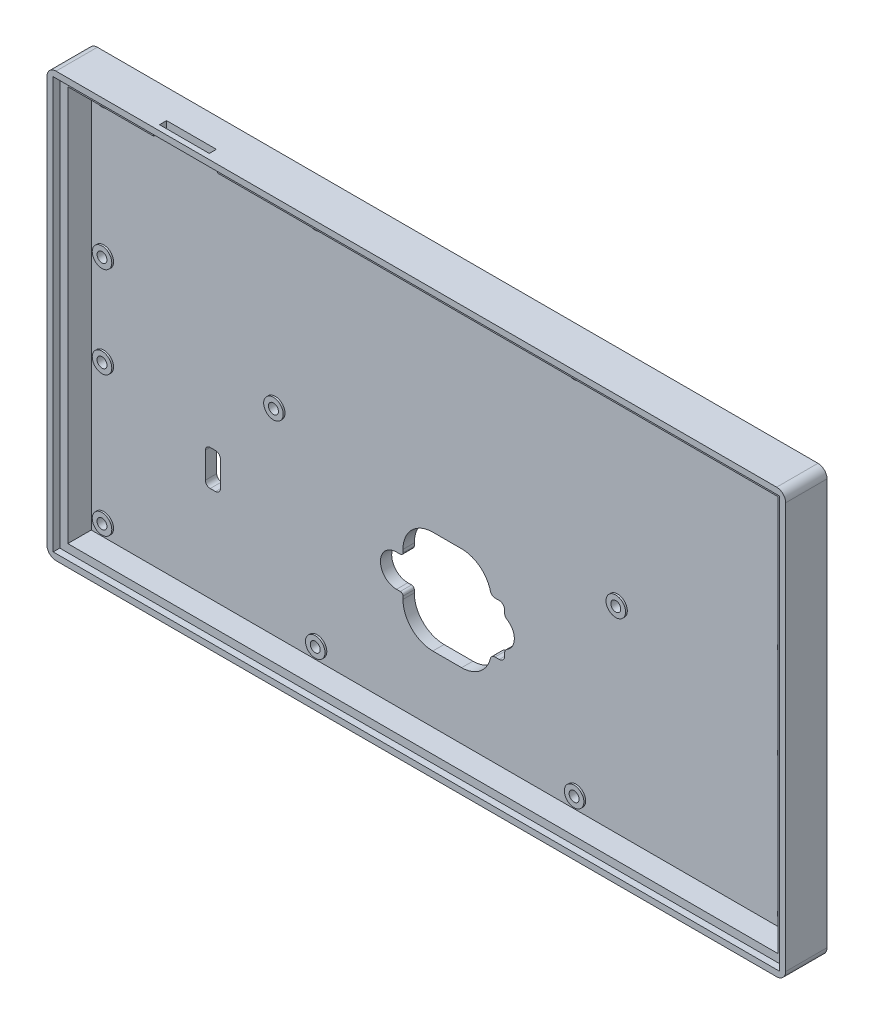
from build123d import *

# Parameters (mm, degrees)
SKETCH4_W           = 207.7922
SKETCH4_H           = 119.2772
SKETCH4_W_2         = 204.2922
SKETCH4_H_2         = 115.7772
BOSS_EXTRUDE1_DEPTH = 1.8542
SKETCH5_W           = 207.7922
SKETCH5_H           = 119.2772
SKETCH5_W_2         = 199.78624
SKETCH5_H_2         = 111.32204
BOSS_EXTRUDE2_DEPTH = 6.604
SKETCH6_W           = 207.7922
SKETCH6_H           = 119.2772
BOSS_EXTRUDE3_DEPTH = 3.175
FILLET1_R           = 2.54
CUT_EXTRUDE2_REACH  = 122.095
SKETCH11_R          = 1.4
CUT_EXTRUDE3_REACH  = 160.609
SKETCH12_W          = 14
SKETCH12_H          = 2
SKETCH13_W          = 18
SKETCH13_H          = 2.22758
CUT_EXTRUDE4_DEPTH  = 1.6458
BOSS_EXTRUDE4_START = 0.5
SKETCH14_R          = 2.75
SKETCH14_R_2        = 1.4
BOSS_EXTRUDE4_DEPTH = 0.5
CUT_EXTRUDE5_REACH  = 122.095


with BuildPart() as part:
    # Sketch4 → Boss-Extrude1 (new body)
    with BuildSketch(Plane.XY):
        Rectangle(SKETCH4_W, SKETCH4_H)
        Rectangle(SKETCH4_W_2, SKETCH4_H_2, mode=Mode.SUBTRACT)
    extrude(amount=-BOSS_EXTRUDE1_DEPTH)

    # Sketch5 → Boss-Extrude2 (add)
    with BuildSketch(Plane(origin=(0, 0, -1.8542), x_dir=(-1, 0, 0), z_dir=(0, 0, -1))):
        Rectangle(SKETCH5_W, SKETCH5_H)
        Rectangle(SKETCH5_W_2, SKETCH5_H_2, mode=Mode.SUBTRACT)
    extrude(amount=BOSS_EXTRUDE2_DEPTH)

    # Sketch6 → Boss-Extrude3 (add)
    with BuildSketch(Plane(origin=(0, 0, -8.4582), x_dir=(-1, 0, 0), z_dir=(0, 0, -1))):
        Rectangle(SKETCH6_W, SKETCH6_H)
        with BuildLine():
            Line((12.20978, -27.9219), (12.20978, -28.722))
            ThreePointArc((12.20978, -28.722), (9.75474904, -34.64896904), (3.82778, -37.104))
            Line((3.82778, -37.104), (-4.286513327, -37.104))
            ThreePointArc((-4.286513327, -37.104), (-9.435955354, -35.33571082), (-12.412717205, -30.776929327))
            ThreePointArc((-12.412717205, -30.776929327), (-12.871637448, -30.074112906), (-13.665514588, -29.8015))
            Line((-13.665514588, -29.8015), (-14.86662, -29.8015))
            ThreePointArc((-14.86662, -29.8015), (-15.944250735, -29.355130735), (-16.39062, -28.2775))
            Line((-16.39062, -28.2775), (-16.39062, -27.445921371))
            ThreePointArc((-16.39062, -27.445921371), (-16.569977638, -26.762670142), (-17.061799901, -26.255607753))
            ThreePointArc((-17.061799901, -26.255607753), (-19.10842, -22.626), (-17.061799901, -18.996392247))
            ThreePointArc((-17.061799901, -18.996392247), (-16.569977638, -18.489329858), (-16.39062, -17.806078629))
            Line((-16.39062, -17.806078629), (-16.39062, -16.9745))
            ThreePointArc((-16.39062, -16.9745), (-15.944250735, -15.896869265), (-14.86662, -15.4505))
            Line((-14.86662, -15.4505), (-13.665514588, -15.4505))
            ThreePointArc((-13.665514588, -15.4505), (-12.871637448, -15.177887094), (-12.412717205, -14.475070673))
            ThreePointArc((-12.412717205, -14.475070673), (-9.435955354, -9.91628918), (-4.286513327, -8.148))
            Line((-4.286513327, -8.148), (3.82778, -8.148))
            ThreePointArc((3.82778, -8.148), (9.75474904, -10.60303096), (12.20978, -16.53))
            Line((12.20978, -16.53), (12.20978, -17.3301))
            ThreePointArc((12.20978, -17.3301), (12.432964633, -17.868915367), (12.97178, -18.0921))
            Line((12.97178, -18.0921), (14.02588, -18.0921))
            ThreePointArc((14.02588, -18.0921), (18.55978, -22.626), (14.02588, -27.1599))
            Line((14.02588, -27.1599), (12.97178, -27.1599))
            ThreePointArc((12.97178, -27.1599), (12.432964633, -27.383084633), (12.20978, -27.9219))
        make_face(mode=Mode.SUBTRACT)
    extrude(amount=BOSS_EXTRUDE3_DEPTH)

    # Fillet1
    fillet1_edges = [part.edges().sort_by_distance(p)[0] for p in [
        (-103.8961, -59.6386, -5.8166),
        (103.8961, -59.6386, -5.8166),
        (103.8961, 59.6386, -5.8166),
        (-103.8961, 59.6386, -5.8166),
    ]]
    fillet(fillet1_edges, radius=FILLET1_R)

    # Sketch11 → Cut-Extrude2 (cut, up to next)
    with BuildSketch(Plane.XY.offset(-8.4582), mode=Mode.PRIVATE) as cut_extrude2_sk1:
        with Locations((-96.377, 52.1375)):
            Circle(SKETCH11_R)
    cut_extrude2_tool1 = extrude(cut_extrude2_sk1.sketch, amount=-CUT_EXTRUDE2_REACH, mode=Mode.PRIVATE) & part.part
    # Sketch11 → Cut-Extrude2 (cut, up to next)
    with BuildSketch(Plane.XY.offset(-8.4582), mode=Mode.PRIVATE) as cut_extrude2_sk2:
        with Locations((96.377, 52.1375)):
            Circle(SKETCH11_R)
    cut_extrude2_tool2 = extrude(cut_extrude2_sk2.sketch, amount=-CUT_EXTRUDE2_REACH, mode=Mode.PRIVATE) & part.part
    # Sketch11 → Cut-Extrude2 (cut, up to next)
    with BuildSketch(Plane.XY.offset(-8.4582), mode=Mode.PRIVATE) as cut_extrude2_sk3:
        with Locations((-96.377, -52.1375)):
            Circle(SKETCH11_R)
    cut_extrude2_tool3 = extrude(cut_extrude2_sk3.sketch, amount=-CUT_EXTRUDE2_REACH, mode=Mode.PRIVATE) & part.part
    # Sketch11 → Cut-Extrude2 (cut, up to next)
    with BuildSketch(Plane.XY.offset(-8.4582), mode=Mode.PRIVATE) as cut_extrude2_sk4:
        with Locations((96.377, -52.1375)):
            Circle(SKETCH11_R)
    cut_extrude2_tool4 = extrude(cut_extrude2_sk4.sketch, amount=-CUT_EXTRUDE2_REACH, mode=Mode.PRIVATE) & part.part
    # Sketch11 → Cut-Extrude2 (cut, up to next)
    with BuildSketch(Plane.XY.offset(-8.4582), mode=Mode.PRIVATE) as cut_extrude2_sk5:
        with Locations((96.377, -12.8125)):
            Circle(SKETCH11_R)
    cut_extrude2_tool5 = extrude(cut_extrude2_sk5.sketch, amount=-CUT_EXTRUDE2_REACH, mode=Mode.PRIVATE) & part.part
    # Sketch11 → Cut-Extrude2 (cut, up to next)
    with BuildSketch(Plane.XY.offset(-8.4582), mode=Mode.PRIVATE) as cut_extrude2_sk6:
        with Locations((96.377, 12.8125)):
            Circle(SKETCH11_R)
    cut_extrude2_tool6 = extrude(cut_extrude2_sk6.sketch, amount=-CUT_EXTRUDE2_REACH, mode=Mode.PRIVATE) & part.part
    # Sketch11 → Cut-Extrude2 (cut, up to next)
    with BuildSketch(Plane.XY.offset(-8.4582), mode=Mode.PRIVATE) as cut_extrude2_sk7:
        with Locations((-96.377, -12.8125)):
            Circle(SKETCH11_R)
    cut_extrude2_tool7 = extrude(cut_extrude2_sk7.sketch, amount=-CUT_EXTRUDE2_REACH, mode=Mode.PRIVATE) & part.part
    # Sketch11 → Cut-Extrude2 (cut, up to next)
    with BuildSketch(Plane.XY.offset(-8.4582), mode=Mode.PRIVATE) as cut_extrude2_sk8:
        with Locations((-96.377, 12.8125)):
            Circle(SKETCH11_R)
    cut_extrude2_tool8 = extrude(cut_extrude2_sk8.sketch, amount=-CUT_EXTRUDE2_REACH, mode=Mode.PRIVATE) & part.part
    # Sketch11 → Cut-Extrude2 (cut, up to next)
    with BuildSketch(Plane.XY.offset(-8.4582), mode=Mode.PRIVATE) as cut_extrude2_sk9:
        with Locations((-36.393, 52.1375)):
            Circle(SKETCH11_R)
    cut_extrude2_tool9 = extrude(cut_extrude2_sk9.sketch, amount=-CUT_EXTRUDE2_REACH, mode=Mode.PRIVATE) & part.part
    # Sketch11 → Cut-Extrude2 (cut, up to next)
    with BuildSketch(Plane.XY.offset(-8.4582), mode=Mode.PRIVATE) as cut_extrude2_sk10:
        with Locations((36.427, 52.1375)):
            Circle(SKETCH11_R)
    cut_extrude2_tool10 = extrude(cut_extrude2_sk10.sketch, amount=-CUT_EXTRUDE2_REACH, mode=Mode.PRIVATE) & part.part
    # Sketch11 → Cut-Extrude2 (cut, up to next)
    with BuildSketch(Plane.XY.offset(-8.4582), mode=Mode.PRIVATE) as cut_extrude2_sk11:
        with Locations((36.427, -52.1375)):
            Circle(SKETCH11_R)
    cut_extrude2_tool11 = extrude(cut_extrude2_sk11.sketch, amount=-CUT_EXTRUDE2_REACH, mode=Mode.PRIVATE) & part.part
    # Sketch11 → Cut-Extrude2 (cut, up to next)
    with BuildSketch(Plane.XY.offset(-8.4582), mode=Mode.PRIVATE) as cut_extrude2_sk12:
        with Locations((-36.393, -52.1375)):
            Circle(SKETCH11_R)
    cut_extrude2_tool12 = extrude(cut_extrude2_sk12.sketch, amount=-CUT_EXTRUDE2_REACH, mode=Mode.PRIVATE) & part.part
    # Sketch11 → Cut-Extrude2 (cut, up to next)
    with BuildSketch(Plane.XY.offset(-8.4582), mode=Mode.PRIVATE) as cut_extrude2_sk13:
        with Locations((-48.148, 0.0375)):
            Circle(SKETCH11_R)
    cut_extrude2_tool13 = extrude(cut_extrude2_sk13.sketch, amount=-CUT_EXTRUDE2_REACH, mode=Mode.PRIVATE) & part.part
    # Sketch11 → Cut-Extrude2 (cut, up to next)
    with BuildSketch(Plane.XY.offset(-8.4582), mode=Mode.PRIVATE) as cut_extrude2_sk14:
        with Locations((48.148, 0.0375)):
            Circle(SKETCH11_R)
    cut_extrude2_tool14 = extrude(cut_extrude2_sk14.sketch, amount=-CUT_EXTRUDE2_REACH, mode=Mode.PRIVATE) & part.part
    add(cut_extrude2_tool1.solids().sort_by_distance((-96.377, 52.1375, -8.4582))[0], mode=Mode.SUBTRACT)
    add(cut_extrude2_tool2.solids().sort_by_distance((96.377, 52.1375, -8.4582))[0], mode=Mode.SUBTRACT)
    add(cut_extrude2_tool3.solids().sort_by_distance((-96.377, -52.1375, -8.4582))[0], mode=Mode.SUBTRACT)
    add(cut_extrude2_tool4.solids().sort_by_distance((96.377, -52.1375, -8.4582))[0], mode=Mode.SUBTRACT)
    add(cut_extrude2_tool5.solids().sort_by_distance((96.377, -12.8125, -8.4582))[0], mode=Mode.SUBTRACT)
    add(cut_extrude2_tool6.solids().sort_by_distance((96.377, 12.8125, -8.4582))[0], mode=Mode.SUBTRACT)
    add(cut_extrude2_tool7.solids().sort_by_distance((-96.377, -12.8125, -8.4582))[0], mode=Mode.SUBTRACT)
    add(cut_extrude2_tool8.solids().sort_by_distance((-96.377, 12.8125, -8.4582))[0], mode=Mode.SUBTRACT)
    add(cut_extrude2_tool9.solids().sort_by_distance((-36.393, 52.1375, -8.4582))[0], mode=Mode.SUBTRACT)
    add(cut_extrude2_tool10.solids().sort_by_distance((36.427, 52.1375, -8.4582))[0], mode=Mode.SUBTRACT)
    add(cut_extrude2_tool11.solids().sort_by_distance((36.427, -52.1375, -8.4582))[0], mode=Mode.SUBTRACT)
    add(cut_extrude2_tool12.solids().sort_by_distance((-36.393, -52.1375, -8.4582))[0], mode=Mode.SUBTRACT)
    add(cut_extrude2_tool13.solids().sort_by_distance((-48.148, 0.0375, -8.4582))[0], mode=Mode.SUBTRACT)
    add(cut_extrude2_tool14.solids().sort_by_distance((48.148, 0.0375, -8.4582))[0], mode=Mode.SUBTRACT)

    # Sketch12 → Cut-Extrude3 (cut, up to next)
    with BuildSketch(Plane(origin=(0, 59.6386, 0), x_dir=(1, 0, 0), z_dir=(0, 1, 0)), mode=Mode.PRIVATE) as cut_extrude3_sk1:
        with Locations((-66.7461, 2.5)):
            Rectangle(SKETCH12_W, SKETCH12_H)
    cut_extrude3_tool1 = extrude(cut_extrude3_sk1.sketch, amount=-CUT_EXTRUDE3_REACH, mode=Mode.PRIVATE) & part.part
    add(cut_extrude3_tool1.solids().sort_by_distance((-66.7461, 59.6386, -2.5))[0], mode=Mode.SUBTRACT)

    # Sketch13 → Cut-Extrude4 (cut)
    with BuildSketch(Plane.XY.offset(-1.8542)):
        with Locations((-66.7461, 56.77481)):
            Rectangle(SKETCH13_W, SKETCH13_H)
    extrude(amount=-CUT_EXTRUDE4_DEPTH, mode=Mode.SUBTRACT)

    # Sketch14 → Boss-Extrude4 (add)
    # profile 1 of 14: a face of its own
    with BuildSketch(Plane.XY.offset(-8.4582).offset(BOSS_EXTRUDE4_START)):
        with Locations(Location((-96.377, 52.1375, 0), (0, 0, 180))):
            Circle(SKETCH14_R)
        with Locations((-96.377, 52.1375)):
            Circle(SKETCH14_R_2, mode=Mode.SUBTRACT)
    # profile 2 of 14: a face of its own
    with BuildSketch(Plane.XY.offset(-8.4582).offset(BOSS_EXTRUDE4_START)):
        with Locations(Location((-36.393, 52.1375, 0), (0, 0, 180))):
            Circle(SKETCH14_R)
        with Locations((-36.393, 52.1375)):
            Circle(SKETCH14_R_2, mode=Mode.SUBTRACT)
    # profile 3 of 14: a face of its own
    with BuildSketch(Plane.XY.offset(-8.4582).offset(BOSS_EXTRUDE4_START)):
        with Locations(Location((36.427, 52.1375, 0), (0, 0, 180))):
            Circle(SKETCH14_R)
        with Locations((36.427, 52.1375)):
            Circle(SKETCH14_R_2, mode=Mode.SUBTRACT)
    # profile 4 of 14: a face of its own
    with BuildSketch(Plane.XY.offset(-8.4582).offset(BOSS_EXTRUDE4_START)):
        with Locations(Location((96.377, 52.1375, 0), (0, 0, 180))):
            Circle(SKETCH14_R)
        with Locations((96.377, 52.1375)):
            Circle(SKETCH14_R_2, mode=Mode.SUBTRACT)
    # profile 5 of 14: a face of its own
    with BuildSketch(Plane.XY.offset(-8.4582).offset(BOSS_EXTRUDE4_START)):
        with Locations(Location((-96.377, 12.8125, 0), (0, 0, 180))):
            Circle(SKETCH14_R)
        with Locations((-96.377, 12.8125)):
            Circle(SKETCH14_R_2, mode=Mode.SUBTRACT)
    # profile 6 of 14: a face of its own
    with BuildSketch(Plane.XY.offset(-8.4582).offset(BOSS_EXTRUDE4_START)):
        with Locations(Location((-48.148, 0.0375, 0), (0, 0, 180))):
            Circle(SKETCH14_R)
        with Locations((-48.148, 0.0375)):
            Circle(SKETCH14_R_2, mode=Mode.SUBTRACT)
    # profile 7 of 14: a face of its own
    with BuildSketch(Plane.XY.offset(-8.4582).offset(BOSS_EXTRUDE4_START)):
        with Locations(Location((-96.377, -12.8125, 0), (0, 0, 180))):
            Circle(SKETCH14_R)
        with Locations((-96.377, -12.8125)):
            Circle(SKETCH14_R_2, mode=Mode.SUBTRACT)
    # profile 8 of 14: a face of its own
    with BuildSketch(Plane.XY.offset(-8.4582).offset(BOSS_EXTRUDE4_START)):
        with Locations(Location((-96.377, -52.1375, 0), (0, 0, 180))):
            Circle(SKETCH14_R)
        with Locations((-96.377, -52.1375)):
            Circle(SKETCH14_R_2, mode=Mode.SUBTRACT)
    # profile 9 of 14: a face of its own
    with BuildSketch(Plane.XY.offset(-8.4582).offset(BOSS_EXTRUDE4_START)):
        with Locations(Location((-36.393, -52.1375, 0), (0, 0, 180))):
            Circle(SKETCH14_R)
        with Locations((-36.393, -52.1375)):
            Circle(SKETCH14_R_2, mode=Mode.SUBTRACT)
    # profile 10 of 14: a face of its own
    with BuildSketch(Plane.XY.offset(-8.4582).offset(BOSS_EXTRUDE4_START)):
        with Locations(Location((48.148, 0.0375, 0), (0, 0, 180))):
            Circle(SKETCH14_R)
        with Locations((48.148, 0.0375)):
            Circle(SKETCH14_R_2, mode=Mode.SUBTRACT)
    # profile 11 of 14: a face of its own
    with BuildSketch(Plane.XY.offset(-8.4582).offset(BOSS_EXTRUDE4_START)):
        with Locations(Location((36.427, -52.1375, 0), (0, 0, 180))):
            Circle(SKETCH14_R)
        with Locations((36.427, -52.1375)):
            Circle(SKETCH14_R_2, mode=Mode.SUBTRACT)
    # profile 12 of 14: a face of its own
    with BuildSketch(Plane.XY.offset(-8.4582).offset(BOSS_EXTRUDE4_START)):
        with Locations(Location((96.377, -52.1375, 0), (0, 0, 180))):
            Circle(SKETCH14_R)
        with Locations((96.377, -52.1375)):
            Circle(SKETCH14_R_2, mode=Mode.SUBTRACT)
    # profile 13 of 14: a face of its own
    with BuildSketch(Plane.XY.offset(-8.4582).offset(BOSS_EXTRUDE4_START)):
        with Locations(Location((96.377, -12.8125, 0), (0, 0, 180))):
            Circle(SKETCH14_R)
        with Locations((96.377, -12.8125)):
            Circle(SKETCH14_R_2, mode=Mode.SUBTRACT)
    # profile 14 of 14: a face of its own
    with BuildSketch(Plane.XY.offset(-8.4582).offset(BOSS_EXTRUDE4_START)):
        with Locations(Location((96.377, 12.8125, 0), (0, 0, 180))):
            Circle(SKETCH14_R)
        with Locations((96.377, 12.8125)):
            Circle(SKETCH14_R_2, mode=Mode.SUBTRACT)
    extrude(amount=-BOSS_EXTRUDE4_DEPTH)

    # Sketch15 → Cut-Extrude5 (cut, up to next)
    with BuildSketch(Plane.XY.offset(-8.4582), mode=Mode.PRIVATE) as cut_extrude5_sk1:
        with BuildLine():
            Line((-66.43712, -18.81202), (-64.93712, -18.81202))
            ThreePointArc((-64.93712, -18.81202), (-63.982525845, -19.207425845), (-63.58712, -20.16202))
            Line((-63.58712, -20.16202), (-63.58712, -27.46202))
            ThreePointArc((-63.58712, -27.46202), (-63.982525845, -28.416614155), (-64.93712, -28.81202))
            Line((-64.93712, -28.81202), (-66.43712, -28.81202))
            ThreePointArc((-66.43712, -28.81202), (-67.391714155, -28.416614155), (-67.78712, -27.46202))
            Line((-67.78712, -27.46202), (-67.78712, -20.16202))
            ThreePointArc((-67.78712, -20.16202), (-67.391714155, -19.207425845), (-66.43712, -18.81202))
        make_face()
    cut_extrude5_tool1 = extrude(cut_extrude5_sk1.sketch, amount=-CUT_EXTRUDE5_REACH, mode=Mode.PRIVATE) & part.part
    add(cut_extrude5_tool1.solids().sort_by_distance((-65.68712, -23.81202, -8.4582))[0], mode=Mode.SUBTRACT)


solid = part.part
